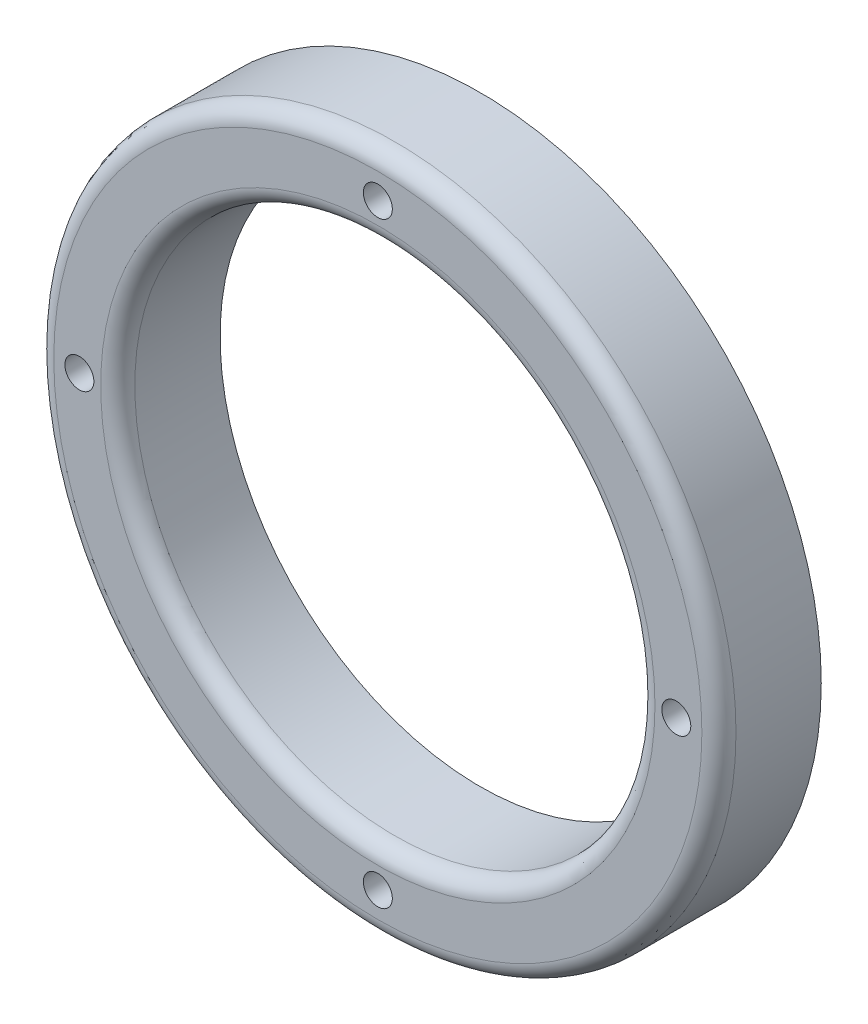
from build123d import *

# Parameters (mm, degrees)
SKETCH_1_R          = 40
SKETCH_1_R_2        = 30.5
EXTRUDE_1_DEPTH     = 12
SKETCH_2_R          = 1.7
CUT_EXTRUDE_1_DEPTH = 12
FILLET_1_R          = 2
FILLET_2_R          = 2


with BuildPart() as part:
    # 草图1 → 凸台-拉伸1 (new body)
    with BuildSketch(Plane.XY):
        Circle(SKETCH_1_R)
        Circle(SKETCH_1_R_2, mode=Mode.SUBTRACT)
    extrude(amount=EXTRUDE_1_DEPTH)

    # 草图2 → 切除-拉伸1 (cut)
    with BuildSketch(Plane.XY.offset(12)):
        with Locations((35, 0)):
            Circle(SKETCH_2_R)
        with Locations((0, -35)):
            Circle(SKETCH_2_R)
        with Locations((-35, 0)):
            Circle(SKETCH_2_R)
        with Locations((0, 35)):
            Circle(SKETCH_2_R)
    extrude(amount=-CUT_EXTRUDE_1_DEPTH, mode=Mode.SUBTRACT)

    # 圆角1
    fillet_1_edges = [part.edges().sort_by_distance(p)[0] for p in [
        (-30.5, 0, 12),
    ]]
    fillet(fillet_1_edges, radius=FILLET_1_R)

    # 圆角2
    fillet_2_edges = [part.edges().sort_by_distance(p)[0] for p in [
        (-40, 0, 12),
    ]]
    fillet(fillet_2_edges, radius=FILLET_2_R)


solid = part.part
